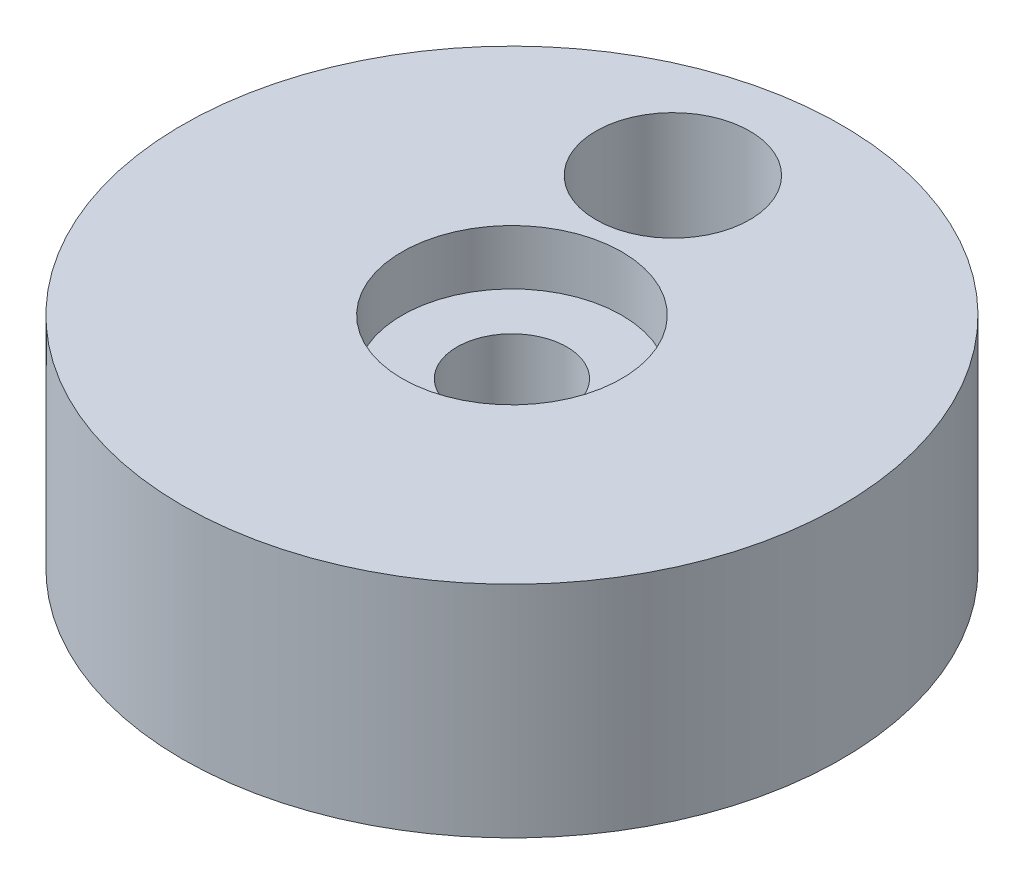
from build123d import *

# Parameters (mm, degrees)
SKETCH1_R           = 19.05
BOSS_EXTRUDE1_DEPTH = 12.7
SKETCH2_R           = 3.175
CUT_EXTRUDE1_DEPTH  = 17.78
SKETCH3_R           = 6.35
CUT_EXTRUDE2_DEPTH  = 3.175
SKETCH4_R           = 4.445
CUT_EXTRUDE3_DEPTH  = 38.1
SKETCH5_R           = 6.604
CUT_EXTRUDE4_DEPTH  = 6.35


with BuildPart() as part:
    # Sketch1 → Boss-Extrude1 (new body)
    with BuildSketch(Plane(origin=(0, 0, 0), x_dir=(1, 0, 0), z_dir=(0, 1, 0))):
        with Locations(Location((0, 0, 0), (0, 0, 270))):
            Circle(SKETCH1_R)
    extrude(amount=-BOSS_EXTRUDE1_DEPTH)

    # Sketch2 → Cut-Extrude1 (cut)
    with BuildSketch(Plane(origin=(0, 0, 0), x_dir=(1, 0, 0), z_dir=(0, 1, 0))):
        with Locations(Location((0, 0, 0), (0, 0, 270))):
            Circle(SKETCH2_R)
    extrude(amount=-CUT_EXTRUDE1_DEPTH, mode=Mode.SUBTRACT)

    # Sketch3 → Cut-Extrude2 (cut)
    with BuildSketch(Plane(origin=(0, 0, 0), x_dir=(1, 0, 0), z_dir=(0, 1, 0))):
        with Locations(Location((0, 0, 0), (0, 0, 270))):
            Circle(SKETCH3_R)
    extrude(amount=-CUT_EXTRUDE2_DEPTH, mode=Mode.SUBTRACT)

    # Sketch4 → Cut-Extrude3 (cut)
    with BuildSketch(Plane(origin=(0, 0, 0), x_dir=(1, 0, 0), z_dir=(0, 1, 0))):
        with Locations(Location((-2.346030642, 11.648567038, 0), (0, 0, 270))):
            Circle(SKETCH4_R)
    extrude(amount=-CUT_EXTRUDE3_DEPTH, mode=Mode.SUBTRACT)

    # Sketch5 → Cut-Extrude4 (cut)
    with BuildSketch(Plane(origin=(0, -12.7, 0), x_dir=(1, 0, 0), z_dir=(0, 1, 0))):
        with Locations((-13.400281264, 17.901049998)):
            Circle(SKETCH5_R)
    extrude(amount=CUT_EXTRUDE4_DEPTH, mode=Mode.SUBTRACT)


solid = part.part
